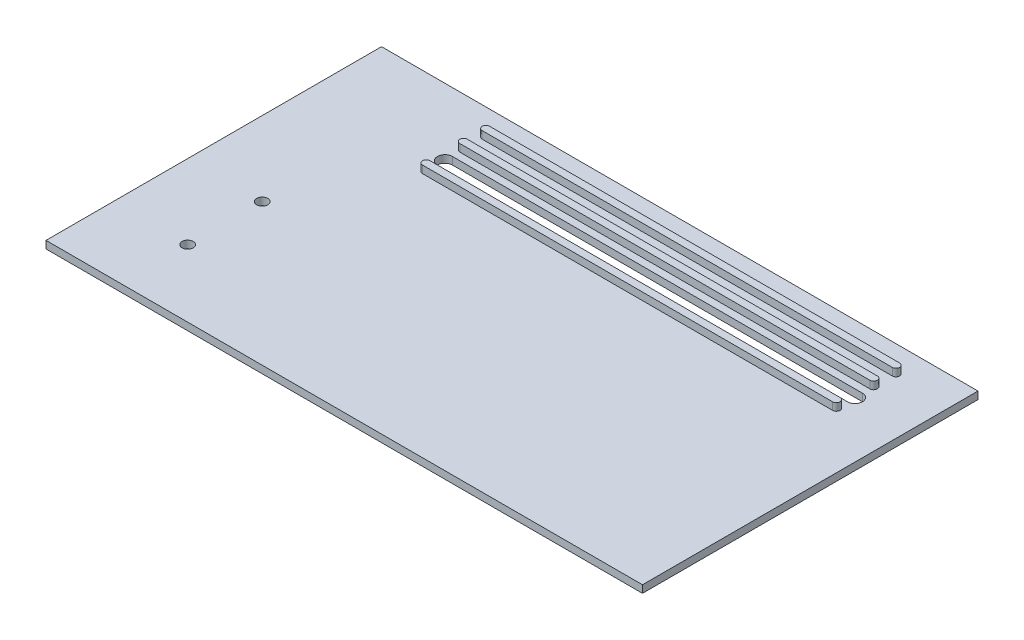
from build123d import *

# Parameters (mm, degrees)
SKETCH1_W           = 800
SKETCH1_H           = 450
SKETCH1_R           = 7.5
BOSS_EXTRUDE1_DEPTH = 10
BOSS_EXTRUDE2_DEPTH = 10


with BuildPart() as part:
    # Sketch1 → Boss-Extrude1 (new body)
    with BuildSketch(Plane(origin=(0, 0, 0), x_dir=(1, 0, 0), z_dir=(0, 1, 0))):
        with Locations((400, 225)):
            Rectangle(SKETCH1_W, SKETCH1_H)
        with Locations(Location((100, 190, 0), (0, 0, 270))):
            Circle(SKETCH1_R, mode=Mode.SUBTRACT)
        with Locations(Location((100, 90, 0), (0, 0, 270))):
            Circle(SKETCH1_R, mode=Mode.SUBTRACT)
        with BuildLine():
            Line((175, 370), (725, 370))
            ThreePointArc((725, 370), (735, 360), (725, 350))
            Line((725, 350), (175, 350))
            ThreePointArc((175, 350), (165, 360), (175, 370))
        make_face(mode=Mode.SUBTRACT)
    extrude(amount=BOSS_EXTRUDE1_DEPTH)

    # Sketch2 → Boss-Extrude2 (add)
    with BuildSketch(Plane(origin=(0, 10, 0), x_dir=(1, 0, 0), z_dir=(0, 1, 0))):
        with BuildLine():
            Line((175, 390), (725, 390))
            ThreePointArc((725, 390), (730, 385), (725, 380))
            Line((725, 380), (175, 380))
            ThreePointArc((175, 380), (170, 385), (175, 390))
        make_face()
        with BuildLine():
            Line((175, 340), (725, 340))
            ThreePointArc((725, 340), (730, 335), (725, 330))
            Line((725, 330), (175, 330))
            ThreePointArc((175, 330), (170, 335), (175, 340))
        make_face()
        with BuildLine():
            Line((175, 420), (725, 420))
            ThreePointArc((725, 420), (730, 415), (725, 410))
            Line((725, 410), (175, 410))
            ThreePointArc((175, 410), (170, 415), (175, 420))
        make_face()
    extrude(amount=BOSS_EXTRUDE2_DEPTH)


solid = part.part
